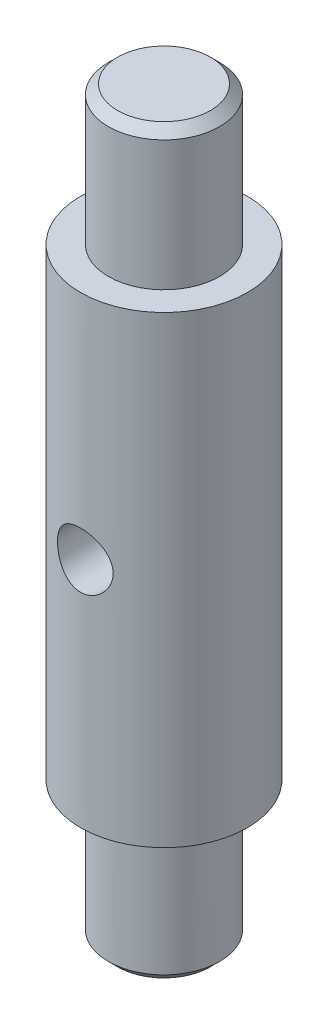
from build123d import *

# Parameters (mm, degrees)
CORTAR_EXTRUIR1_DEPTH      = 82.89017035
CORTAR_EXTRUIR1_DEPTH_BACK = 82.89017035
CROQUIS2_R                 = 3
CROQUIS3_R                 = 3
CORTAR_EXTRUIR2_DEPTH      = 45
CHAFL_N3_SIZE              = 1


with BuildPart() as part:
    # Croquis1 → Revolución1 (revolve)
    with BuildSketch(Plane.XY, mode=Mode.PRIVATE) as revoluci_n1_sk:
        Polygon((0, 0), (0, 15), (-3, 15), (-3, 65), (0, 65), (0, 80), (6, 80), (6, 0), align=None)
    revolve(revoluci_n1_sk.sketch.rotate(Axis((6, 80, 0), (0, -1, 0)), 270), axis=Axis((6, 80, 0), (0, -1, 0)))

    # Croquis2 → Cortar-Extruir1 (cut, two sides: drawn at the far end of the back side and taken through both)
    with BuildSketch(Plane.XY.offset(-CORTAR_EXTRUIR1_DEPTH_BACK)):
        with Locations(Location((6, 40, 0), (0, 0, 90))):
            Circle(CROQUIS2_R)
    extrude(amount=CORTAR_EXTRUIR1_DEPTH + CORTAR_EXTRUIR1_DEPTH_BACK, mode=Mode.SUBTRACT)

    # Croquis3 → Cortar-Extruir2 (cut)
    with BuildSketch(Plane.XZ):
        with Locations(Location((6, 0, 0), (0, 0, 270))):
            Circle(CROQUIS3_R)
    extrude(amount=-CORTAR_EXTRUIR2_DEPTH, mode=Mode.SUBTRACT)

    # Chaflán3
    chafl_n3_edges = [part.edges().sort_by_distance(p)[0] for p in [
        (6, 0, -6),
        (6, 80, -6),
    ]]
    chamfer(chafl_n3_edges, length=CHAFL_N3_SIZE)


solid = part.part
